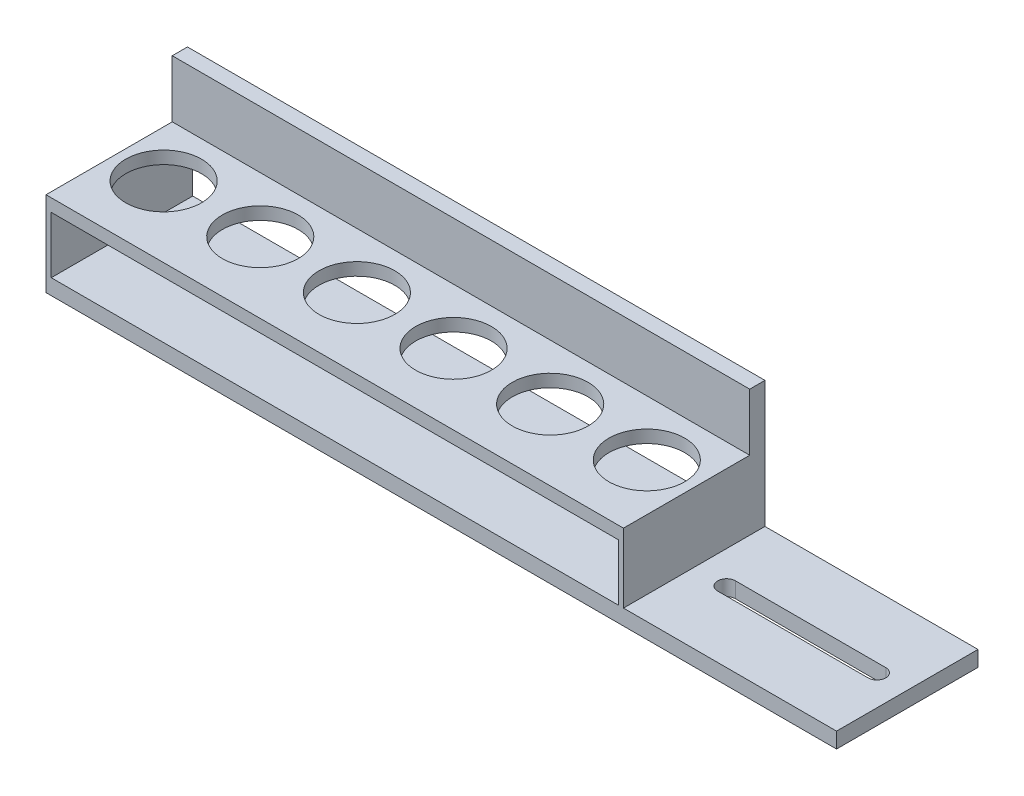
from build123d import *

# Parameters (mm, degrees)
SKETCH_1_W          = 228.6
SKETCH_1_H          = 5
EXTRUDE_1_DEPTH     = 55.99999976
SKETCH_2_R          = 15
CUT_EXTRUDE_1_DEPTH = 28
SKETCH_3_W          = 228.6
SKETCH_3_H          = 6.022861395
EXTRUDE_2_DEPTH     = 22.666
SKETCH_4_W          = 2.077402036
SKETCH_4_H          = 55.99999976
SKETCH_4_W_2        = 2.004864202
EXTRUDE_3_DEPTH     = 22.412
EXTRUDE_4_DEPTH     = 6.156
CUT_EXTRUDE_2_DEPTH = 6.156


with BuildPart() as part:
    # 草图1 → 凸台-拉伸1 (new body)
    with BuildSketch(Plane.XY):
        with Locations((-114.3, 2.5)):
            Rectangle(SKETCH_1_W, SKETCH_1_H)
    extrude(amount=EXTRUDE_1_DEPTH)

    # 草图2 → 切除-拉伸1 (cut)
    with BuildSketch(Plane(origin=(0, 5, 0), x_dir=(1, 0, 0), z_dir=(0, 1, 0))):
        with Locations(Location((-210.039051384, -27.99999988, 0), (0, 0, 180))):
            Circle(SKETCH_2_R)
        with Locations(Location((-171.783646654, -27.99999988, 0), (0, 0, 180))):
            Circle(SKETCH_2_R)
        with Locations(Location((-133.528241924, -27.99999988, 0), (0, 0, 180))):
            Circle(SKETCH_2_R)
        with Locations(Location((-95.272837194, -27.99999988, 0), (0, 0, 180))):
            Circle(SKETCH_2_R)
        with Locations(Location((-57.017432464, -27.99999988, 0), (0, 0, 180))):
            Circle(SKETCH_2_R)
        with Locations(Location((-18.762027734, -27.99999988, 0), (0, 0, 180))):
            Circle(SKETCH_2_R)
    extrude(amount=-CUT_EXTRUDE_1_DEPTH, mode=Mode.SUBTRACT)

    # 草图3 → 凸台-拉伸2 (add)
    with BuildSketch(Plane(origin=(0, 5, 0), x_dir=(1, 0, 0), z_dir=(0, 1, 0))):
        with Locations((-114.3, -3.011430698)):
            Rectangle(SKETCH_3_W, SKETCH_3_H)
    extrude(amount=EXTRUDE_2_DEPTH)

    # 草图4 → 凸台-拉伸3 (add)
    with BuildSketch(Plane.XZ):
        with Locations((-227.561298982, 27.99999988)):
            Rectangle(SKETCH_4_W, SKETCH_4_H)
        with Locations((-1.002432101, 27.99999988)):
            Rectangle(SKETCH_4_W_2, SKETCH_4_H)
    extrude(amount=EXTRUDE_3_DEPTH)

    # 草图5 → 凸台-拉伸4 (add)
    with BuildSketch(Plane.XZ.offset(22.412)):
        Polygon((-228.6, 55.99999976), (-228.6, 0), (-226.522597964, 0), (84.340152487, 0), (84.340152487, 55.99999976), (-226.522597964, 55.99999976), align=None)
    extrude(amount=EXTRUDE_4_DEPTH)

    # 草图7 → 切除-拉伸2 (cut)
    with BuildSketch(Plane.XZ.offset(28.568)):
        with BuildLine():
            Line((12.810419977, 31.513278328), (72.336600875, 31.513278328))
            ThreePointArc((72.336600875, 31.513278328), (75.849879323, 27.99999988), (72.336600875, 24.486721432))
            Line((72.336600875, 24.486721432), (12.810419977, 24.486721432))
            ThreePointArc((12.810419977, 24.486721432), (9.297141529, 27.99999988), (12.810419977, 31.513278328))
        make_face()
    extrude(amount=-CUT_EXTRUDE_2_DEPTH, mode=Mode.SUBTRACT)


solid = part.part
